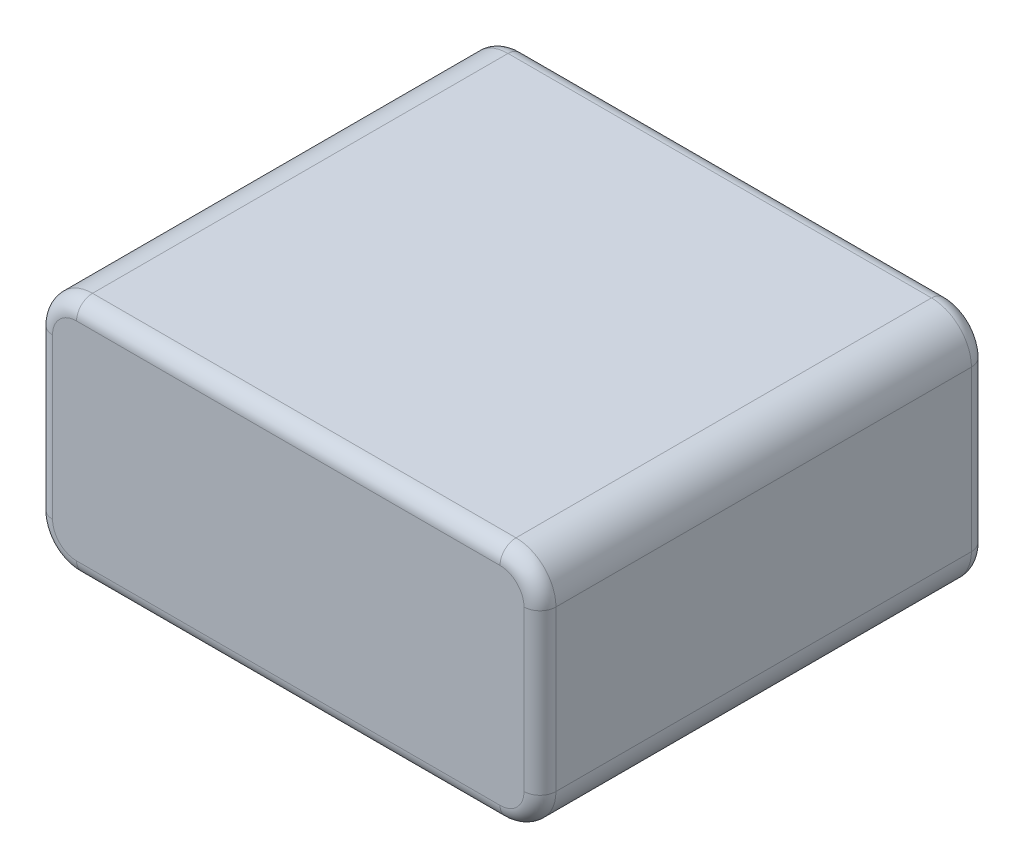
from build123d import *

# Parameters (mm, degrees)
SKETCH2_W           = 63
SKETCH2_H           = 56
BOSS_EXTRUDE1_DEPTH = 30
FILLET1_R           = 5
FILLET2_R           = 2


with BuildPart() as part:
    # Sketch2 → Boss-Extrude1 (new body)
    with BuildSketch(Plane(origin=(0, 0, 0), x_dir=(1, 0, 0), z_dir=(0, 1, 0))):
        Rectangle(SKETCH2_W, SKETCH2_H)
    extrude(amount=BOSS_EXTRUDE1_DEPTH)

    # Fillet1
    fillet1_edges = [part.edges().sort_by_distance(p)[0] for p in [
        (31.5, 30, 0),
        (-31.5, 30, 0),
        (31.5, 0, 0),
        (-31.5, 0, 0),
    ]]
    fillet(fillet1_edges, radius=FILLET1_R)

    # Fillet2
    fillet2_edges = [part.edges().sort_by_distance(p)[0] for p in [
        (-31.5, 15, 28),
        (-31.5, 15, -28),
        (0, 0, 28),
        (31.5, 15, 28),
        (0, 30, 28),
        (30.035533906, 28.535533906, 28),
        (30.035533906, 1.464466094, 28),
        (-30.035533906, 28.535533906, 28),
        (-30.035533906, 1.464466094, 28),
        (0, 0, -28),
        (0, 30, -28),
        (31.5, 15, -28),
        (30.035533906, 28.535533906, -28),
        (30.035533906, 1.464466094, -28),
        (-30.035533906, 28.535533906, -28),
        (-30.035533906, 1.464466094, -28),
    ]]
    fillet(fillet2_edges, radius=FILLET2_R)


solid = part.part
